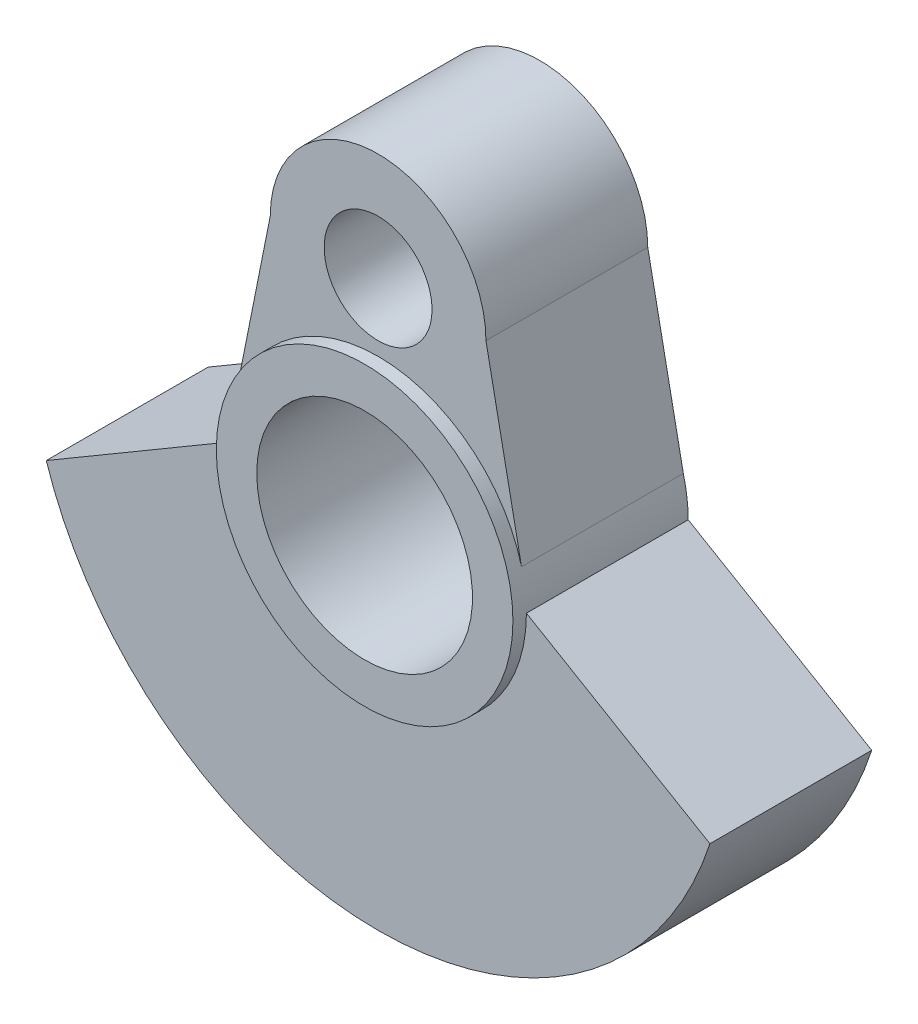
from build123d import *

# Parameters (mm, degrees)
BOSS_EXTRUDE1_DEPTH   = 3
SKETCH1_R             = 2
BOSS_EXTRUDE1_2_DEPTH = 3
BOSS_EXTRUDE2_START   = 3.5
SKETCH1_3_R           = 5.5
SKETCH1_3_R_2         = 4
BOSS_EXTRUDE2_DEPTH   = 6.5


with BuildPart() as part:
    # Sketch1 → Boss-Extrude1 (new, symmetric)
    with BuildSketch(Plane.XY):
        with BuildLine():
            Line((-5.5, 0), (-12.30509606, -4))
            ThreePointArc((-12.30509606, -4), (0, -12.938909887), (12.30509606, -4))
            Line((12.30509606, -4), (5.5, 0))
            ThreePointArc((5.5, 0), (0, -5.5), (-5.5, 0))
        make_face()
    extrude(amount=BOSS_EXTRUDE1_DEPTH, both=True)



with BuildPart() as body_2:
    # Sketch1 → Boss-Extrude1 2 (new, symmetric)
    with BuildSketch(Plane.XY):
        with BuildLine():
            Line((-4, 8), (-5.319261969, 1.398374808))
            ThreePointArc((-5.319261969, 1.398374808), (0, 5.5), (5.319261969, 1.398374808))
            Line((5.319261969, 1.398374808), (4, 8))
            ThreePointArc((4, 8), (0, 12), (-4, 8))
        make_face()
        with Locations((0, 8)):
            Circle(SKETCH1_R, mode=Mode.SUBTRACT)
    extrude(amount=BOSS_EXTRUDE1_2_DEPTH, both=True)


with BuildPart() as part_1:
    add(part.part)

    add(body_2.part)  # Boss-Extrude2 merges body 2
    # Sketch1<3> → Boss-Extrude2 (add)
    with BuildSketch(Plane.XY.offset(BOSS_EXTRUDE2_START)):
        Circle(SKETCH1_3_R)
        with Locations(Location((0, 0, 0), (0, 0, 180))):
            Circle(SKETCH1_3_R_2, mode=Mode.SUBTRACT)
    extrude(amount=-BOSS_EXTRUDE2_DEPTH)


solid = part_1.part
